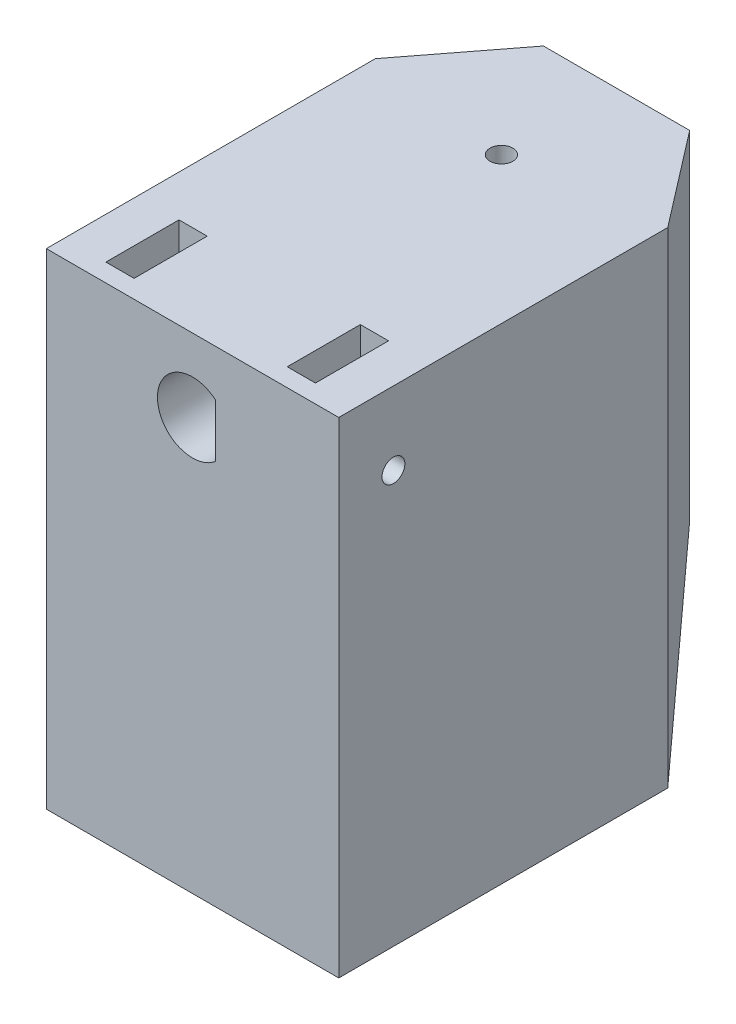
from build123d import *

# Parameters (mm, degrees)
BOSS_EXTRUDE1_DEPTH = 25.4
CUT_EXTRUDE1_DEPTH  = 9.5
SKETCH5_W           = 25.4
SKETCH5_H           = 42.164
BOSS_EXTRUDE2_DEPTH = 11.43
CUT_EXTRUDE2_REACH  = 53.538
CUT_EXTRUDE3_REACH  = 53.255
CUT_EXTRUDE4_DEPTH  = 20
SKETCH10_W          = 19.05
SKETCH10_H          = 19.05
CUT_EXTRUDE5_DEPTH  = 26.289
CUT_EXTRUDE6_REACH  = 55.322
SKETCH11_W          = 1.5875
SKETCH11_H          = 12.7
SKETCH12_R          = 0.9921875
CUT_EXTRUDE7_DEPTH  = 51.724378715
CUT_EXTRUDE8_REACH  = 52.836
SKETCH13_R          = 0.9921875
CUT_EXTRUDE9_START  = -7.875
CUT_EXTRUDE9_DEPTH  = 1.225
CUT_EXTRUDE10_START = 7.875
CUT_EXTRUDE10_DEPTH = 1.225
CUT_EXTRUDE11_REACH = 52.836
SKETCH15_W          = 2.45
SKETCH15_H          = 6.35


with BuildPart() as part:
    # Sketch2 → Boss-Extrude1 (new body)
    with BuildSketch(Plane.XY):
        Polygon((12.7, -6.35), (14.2875, -6.35), (14.2875, 6.35), (-14.2875, 6.35), (-14.2875, -6.35), (-12.7, -6.35), (-12.7, -35.814), (12.7, -35.814), align=None)
    extrude(amount=BOSS_EXTRUDE1_DEPTH)

    # Sketch3 → Cut-Extrude1 (cut)
    with BuildSketch(Plane.XY.offset(25.4)):
        with BuildLine():
            Line((2.003122562, 2.3), (2.003122562, -2.3))
            ThreePointArc((2.003122562, -2.3), (-3.05, 0), (2.003122562, 2.3))
        make_face()
    extrude(amount=-CUT_EXTRUDE1_DEPTH, mode=Mode.SUBTRACT)

    # Sketch5 → Boss-Extrude2 (add)
    with BuildSketch(Plane(origin=(0, 0, 0), x_dir=(-1, 0, 0), z_dir=(0, 0, -1))):
        with Locations((0, -14.732)):
            Rectangle(SKETCH5_W, SKETCH5_H)
    extrude(amount=BOSS_EXTRUDE2_DEPTH)

    # Sketch6 → Cut-Extrude2 (cut, up to next)
    with BuildSketch(Plane(origin=(12.7, 0, 0), x_dir=(0, 0, -1), z_dir=(1, 0, 0)), mode=Mode.PRIVATE) as cut_extrude2_sk1:
        Polygon((3.175, -35.814), (11.43, -23.01875), (11.43, -35.814), align=None)
    cut_extrude2_tool1 = extrude(cut_extrude2_sk1.sketch, amount=-CUT_EXTRUDE2_REACH, mode=Mode.PRIVATE) & part.part
    add(cut_extrude2_tool1.solids().sort_by_distance((12.7, -31.548917, -8.678333))[0], mode=Mode.SUBTRACT)

    # Sketch7 → Cut-Extrude3 (cut, up to next)
    with BuildSketch(Plane.XZ.offset(35.814), mode=Mode.PRIVATE) as cut_extrude3_sk1:
        Polygon((-12.7, -11.43), (-12.7, -3.175), (-6.35, -11.43), align=None)
    cut_extrude3_tool1 = extrude(cut_extrude3_sk1.sketch, amount=-CUT_EXTRUDE3_REACH, mode=Mode.PRIVATE) & part.part
    # Sketch7 → Cut-Extrude3 (cut, up to next)
    with BuildSketch(Plane.XZ.offset(35.814), mode=Mode.PRIVATE) as cut_extrude3_sk2:
        Polygon((6.35, -11.43), (12.7, -3.175), (12.7, -11.43), align=None)
    cut_extrude3_tool2 = extrude(cut_extrude3_sk2.sketch, amount=-CUT_EXTRUDE3_REACH, mode=Mode.PRIVATE) & part.part
    add(cut_extrude3_tool1.solids().sort_by_distance((-10.583333, -35.814, -8.678333))[0], mode=Mode.SUBTRACT)
    add(cut_extrude3_tool2.solids().sort_by_distance((10.583333, -35.814, -8.678333))[0], mode=Mode.SUBTRACT)

    # Sketch8 → Cut-Extrude4 (cut)
    with BuildSketch(Plane(origin=(0, 0, -11.43), x_dir=(-1, 0, 0), z_dir=(0, 0, -1))):
        with BuildLine():
            Line((-1.651, 2.859615883), (1.651, 2.859615883))
            ThreePointArc((1.651, 2.859615883), (0, -3.302), (-1.651, 2.859615883))
        make_face()
    extrude(amount=-CUT_EXTRUDE4_DEPTH, mode=Mode.SUBTRACT)

    # Sketch10 → Cut-Extrude5 (cut)
    with BuildSketch(Plane.XZ.offset(35.814)):
        with Locations((0, 12.7)):
            Rectangle(SKETCH10_W, SKETCH10_H)
    extrude(amount=-CUT_EXTRUDE5_DEPTH, mode=Mode.SUBTRACT)

    # Sketch11 → Cut-Extrude6 (cut, up to next)
    with BuildSketch(Plane.XY.offset(25.4), mode=Mode.PRIVATE) as cut_extrude6_sk1:
        with Locations((-13.49375, 0)):
            Rectangle(SKETCH11_W, SKETCH11_H)
    cut_extrude6_tool1 = extrude(cut_extrude6_sk1.sketch, amount=-CUT_EXTRUDE6_REACH, mode=Mode.PRIVATE) & part.part
    # Sketch11 → Cut-Extrude6 (cut, up to next)
    with BuildSketch(Plane.XY.offset(25.4), mode=Mode.PRIVATE) as cut_extrude6_sk2:
        with Locations((13.49375, 0)):
            Rectangle(SKETCH11_W, SKETCH11_H)
    cut_extrude6_tool2 = extrude(cut_extrude6_sk2.sketch, amount=-CUT_EXTRUDE6_REACH, mode=Mode.PRIVATE) & part.part
    add(cut_extrude6_tool1.solids().sort_by_distance((-13.49375, 0, 25.4))[0], mode=Mode.SUBTRACT)
    add(cut_extrude6_tool2.solids().sort_by_distance((13.49375, 0, 25.4))[0], mode=Mode.SUBTRACT)

    # Sketch12 → Cut-Extrude7 (cut, through all)
    with BuildSketch(Plane(origin=(12.7, 0, 0), x_dir=(0, 0, -1), z_dir=(1, 0, 0))):
        with Locations(Location((-20.65, 0, 0), (0, 0, 90))):
            Circle(SKETCH12_R)
    extrude(amount=-CUT_EXTRUDE7_DEPTH, mode=Mode.SUBTRACT)

    # Sketch13 → Cut-Extrude8 (cut, up to next)
    with BuildSketch(Plane(origin=(0, 6.35, 0), x_dir=(1, 0, 0), z_dir=(0, 1, 0)), mode=Mode.PRIVATE) as cut_extrude8_sk1:
        with Locations(Location((0, 1.43, 0), (0, 0, 180))):
            Circle(SKETCH13_R)
    cut_extrude8_tool1 = extrude(cut_extrude8_sk1.sketch, amount=-CUT_EXTRUDE8_REACH, mode=Mode.PRIVATE) & part.part
    add(cut_extrude8_tool1.solids().sort_by_distance((0, 6.35, -1.43))[0], mode=Mode.SUBTRACT)

    # Sketch14 → Cut-Extrude9 (cut, symmetric)
    with BuildSketch(Plane(origin=(0, 0, 0), x_dir=(0, 0, -1), z_dir=(1, 0, 0)).offset(CUT_EXTRUDE9_START)):
        Polygon((-17.475, 1.833087105), (-20.65, 3.666174209), (-23.825, 1.833087105), (-23.825, -1.833087105), (-20.65, -3.666174209), (-17.475, -1.833087105), align=None)
    extrude(amount=CUT_EXTRUDE9_DEPTH, both=True, mode=Mode.SUBTRACT)

    # Sketch14<2> → Cut-Extrude10 (cut, symmetric)
    with BuildSketch(Plane(origin=(0, 0, 0), x_dir=(0, 0, -1), z_dir=(1, 0, 0)).offset(CUT_EXTRUDE10_START)):
        Polygon((-17.475, 1.833087105), (-20.65, 3.666174209), (-23.825, 1.833087105), (-23.825, -1.833087105), (-20.65, -3.666174209), (-17.475, -1.833087105), align=None)
    extrude(amount=CUT_EXTRUDE10_DEPTH, both=True, mode=Mode.SUBTRACT)

    # Sketch15 → Cut-Extrude11 (cut, up to next)
    with BuildSketch(Plane(origin=(0, 6.35, 0), x_dir=(1, 0, 0), z_dir=(0, 1, 0)), mode=Mode.PRIVATE) as cut_extrude11_sk1:
        with Locations((-7.875, -20.65)):
            Rectangle(SKETCH15_W, SKETCH15_H)
    cut_extrude11_tool1 = extrude(cut_extrude11_sk1.sketch, amount=-CUT_EXTRUDE11_REACH, mode=Mode.PRIVATE) & part.part
    # Sketch15 → Cut-Extrude11 (cut, up to next)
    with BuildSketch(Plane(origin=(0, 6.35, 0), x_dir=(1, 0, 0), z_dir=(0, 1, 0)), mode=Mode.PRIVATE) as cut_extrude11_sk2:
        with Locations((7.875, -20.65)):
            Rectangle(SKETCH15_W, SKETCH15_H)
    cut_extrude11_tool2 = extrude(cut_extrude11_sk2.sketch, amount=-CUT_EXTRUDE11_REACH, mode=Mode.PRIVATE) & part.part
    add(cut_extrude11_tool1.solids().sort_by_distance((-7.875, 6.35, 20.65))[0], mode=Mode.SUBTRACT)
    add(cut_extrude11_tool2.solids().sort_by_distance((7.875, 6.35, 20.65))[0], mode=Mode.SUBTRACT)


solid = part.part
